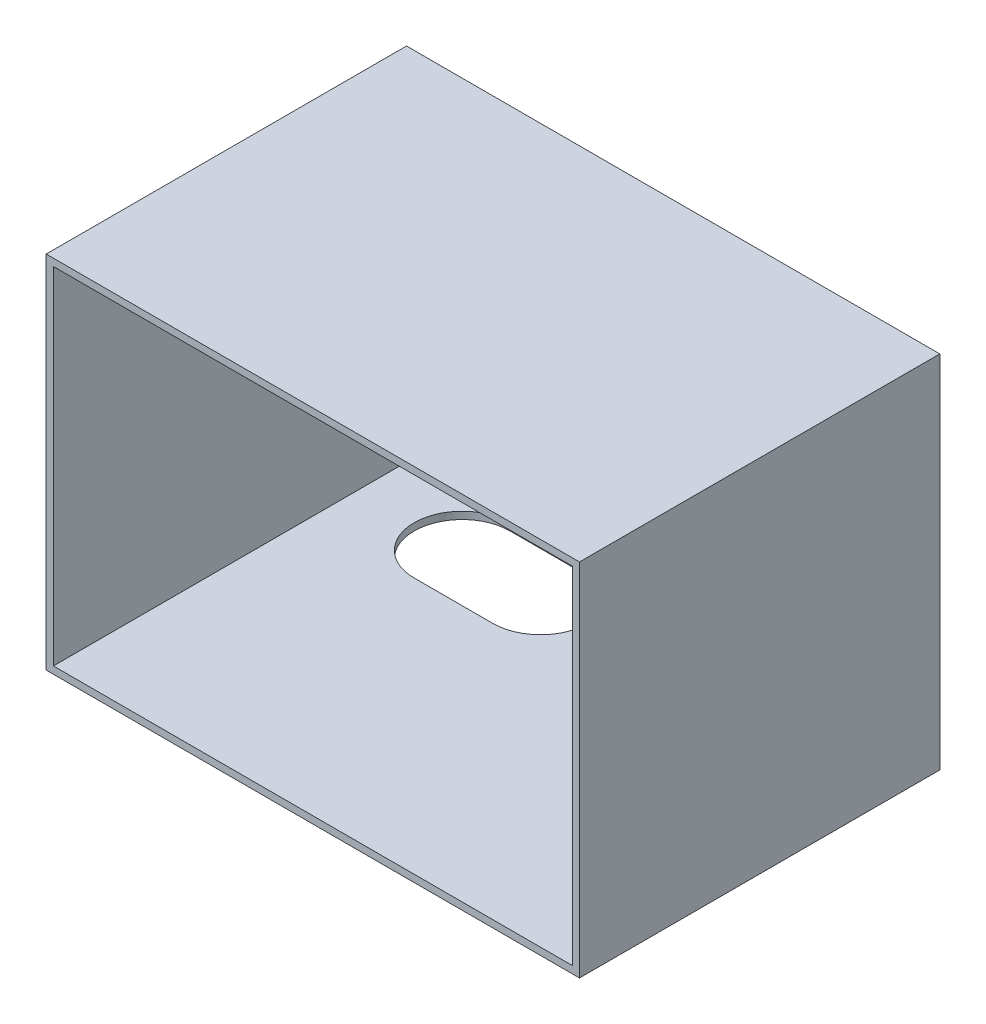
from build123d import *

# Parameters (mm, degrees)
SKETCH1_W           = 187.96
SKETCH1_H           = 127
BOSS_EXTRUDE1_DEPTH = 127
CUT_EXTRUDE1_DEPTH  = 25.4
SKETCH6_R           = 4.699
CUT_EXTRUDE2_DEPTH  = 12.7
SKETCH7_W           = 182.88
SKETCH7_H           = 121.92
CUT_EXTRUDE4_DEPTH  = 99.06
CUT_EXTRUDE5_DEPTH  = 25.4
CUT_EXTRUDE6_DEPTH  = 3.048


with BuildPart() as part:
    # Sketch1 → Boss-Extrude1 (new body)
    with BuildSketch(Plane.XY):
        with Locations((93.98, 63.5)):
            Rectangle(SKETCH1_W, SKETCH1_H)
    extrude(amount=BOSS_EXTRUDE1_DEPTH)

    # Sketch3 → Cut-Extrude1 (cut)
    with BuildSketch(Plane(origin=(0, 0, 0), x_dir=(-1, 0, 0), z_dir=(0, 0, -1))):
        Polygon((-170.18, 0), (-132.08, 0), (-140.929239756, 25.412400336), (-161.150123966, 25.412400336), align=None)
    extrude(amount=-CUT_EXTRUDE1_DEPTH, mode=Mode.SUBTRACT)

    # Sketch6 → Cut-Extrude2 (cut)
    with BuildSketch(Plane.XZ.offset(-25.412400336)):
        with Locations(Location((151.039681861, 7.391433819, 0), (0, 0, 270))):
            Circle(SKETCH6_R)
    extrude(amount=-CUT_EXTRUDE2_DEPTH, mode=Mode.SUBTRACT)

    # Sketch7 → Cut-Extrude4 (cut)
    with BuildSketch(Plane.XY.offset(127)):
        with Locations((93.98, 63.5)):
            Rectangle(SKETCH7_W, SKETCH7_H)
    extrude(amount=-CUT_EXTRUDE4_DEPTH, mode=Mode.SUBTRACT)

    # Sketch9 → Cut-Extrude5 (cut)
    with BuildSketch(Plane.XY.offset(27.94)):
        Polygon((162.943164317, 27.952400336), (171.973040351, 2.54), (185.42, 2.54), (185.42, 124.46), (2.54, 124.46), (2.54, 2.54), (130.274896212, 2.54), (139.124135968, 27.952400336), align=None)
    extrude(amount=-CUT_EXTRUDE5_DEPTH, mode=Mode.SUBTRACT)

    # Sketch10 → Cut-Extrude6 (cut)
    with BuildSketch(Plane.XZ):
        with BuildLine():
            Line((39.281842654, 36.576), (66.929, 36.576))
            ThreePointArc((66.929, 36.576), (83.82, 19.685), (66.929, 2.794))
            Line((66.929, 2.794), (39.281842654, 2.794))
            ThreePointArc((39.281842654, 2.794), (22.390842654, 19.685), (39.281842654, 36.576))
        make_face()
    extrude(amount=-CUT_EXTRUDE6_DEPTH, mode=Mode.SUBTRACT)


solid = part.part
